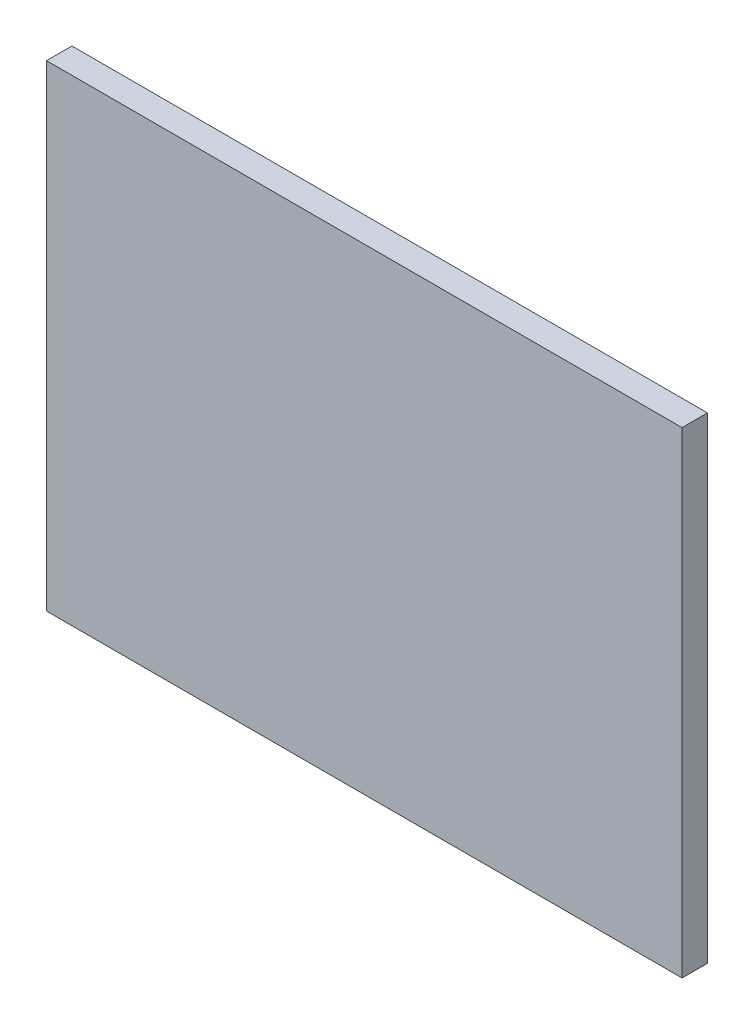
from build123d import *

# Parameters (mm, degrees)
ESQUISSE2_W        = 80
ESQUISSE2_H        = 60
BOSS_EXTRU_1_DEPTH = 3.2


with BuildPart() as part:
    # Esquisse2 → Boss.-Extru.1 (new body)
    with BuildSketch(Plane.XY):
        with Locations((40, 30)):
            Rectangle(ESQUISSE2_W, ESQUISSE2_H)
    extrude(amount=BOSS_EXTRU_1_DEPTH)


solid = part.part
